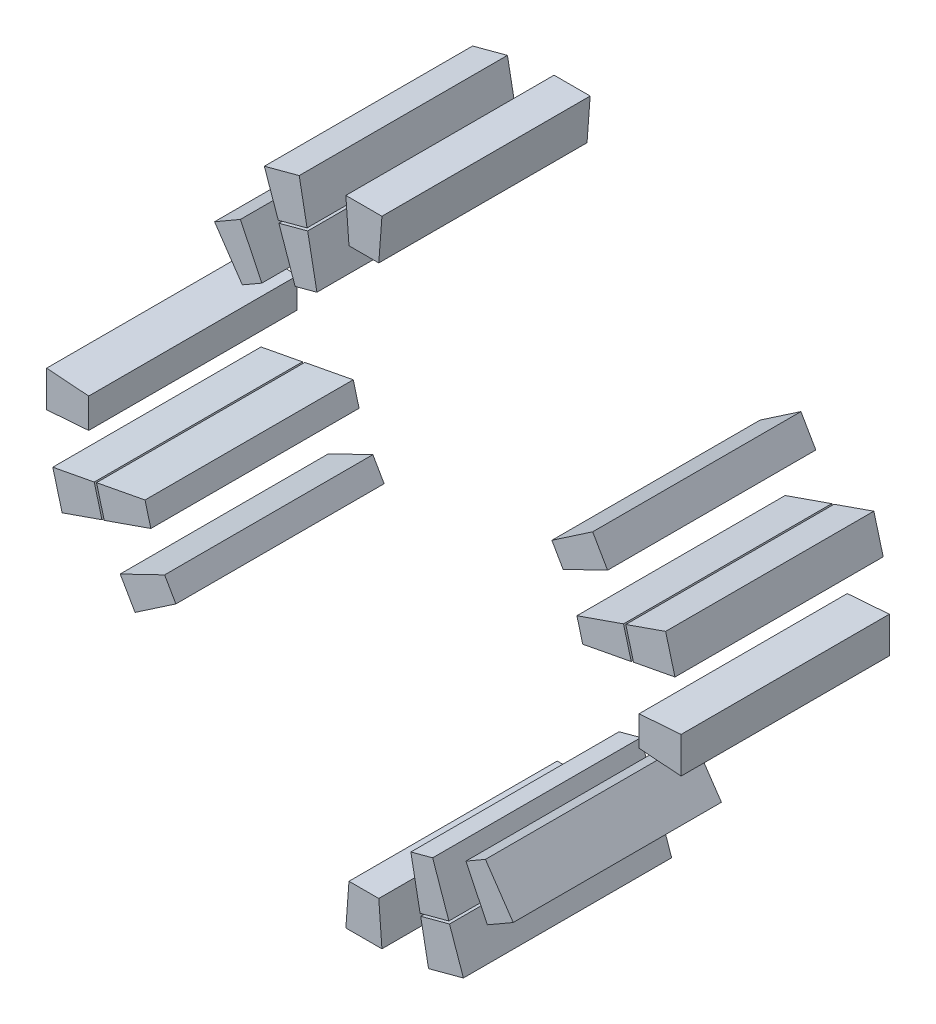
from build123d import *

# Parameters (mm, degrees)
COIL_SIDES_START    = -15
COIL_SIDES_DEPTH    = 30
COIL_SIDES_2_DEPTH  = 30
COIL_SIDES_3_DEPTH  = 30
COIL_SIDES_4_DEPTH  = 30
COIL_SIDES_5_DEPTH  = 30
COIL_SIDES_6_DEPTH  = 30
COIL_SIDES_7_DEPTH  = 30
COIL_SIDES_8_DEPTH  = 30
COIL_SIDES_9_DEPTH  = 30
COIL_SIDES_10_DEPTH = 30
COIL_SIDES_11_DEPTH = 30
COIL_SIDES_12_DEPTH = 30
COIL_SIDES_13_DEPTH = 30
COIL_SIDES_14_DEPTH = 30
COIL_SIDES_15_DEPTH = 30
COIL_SIDES_16_DEPTH = 30


with BuildPart() as part:
    # Эскиз1 → Coil_sides (new body)
    with BuildSketch(Plane.XY.offset(COIL_SIDES_START)):
        Polygon((39.64188455, -2.147321429), (45.7, -2.6), (45.7, 2.6), (39.64188455, 2.147321429), align=None)
    extrude(amount=COIL_SIDES_DEPTH)


with BuildPart() as body_2:
    # Эскиз1 → Coil_sides 2 (new body)
    with BuildSketch(Plane.XY.offset(COIL_SIDES_START)):
        Polygon((31.532118785, 6.766681971), (38.516652655, 8.097435247), (37.405117291, 12.245741698), (30.690956889, 9.905940906), align=None)
    extrude(amount=COIL_SIDES_2_DEPTH)


with BuildPart() as body_3:
    # Эскиз1 → Coil_sides 3 (new body)
    with BuildSketch(Plane.XY.offset(COIL_SIDES_START)):
        Polygon((38.846887771, 8.18592148), (44.815739779, 9.316623213), (43.469880744, 14.33943751), (37.735352408, 12.334227931), align=None)
    extrude(amount=COIL_SIDES_3_DEPTH)


with BuildPart() as body_4:
    # Эскиз1 → Coil_sides 4 (new body)
    with BuildSketch(Plane.XY.offset(COIL_SIDES_START)):
        Polygon((28.706341726, 14.697225748), (35.108459083, 17.790365093), (32.961137654, 21.509634907), (27.081341726, 17.511808311), align=None)
    extrude(amount=COIL_SIDES_4_DEPTH)


with BuildPart() as body_5:
    # Эскиз1 → Coil_sides 5 (new body)
    with BuildSketch(Plane.XY.offset(COIL_SIDES_START)):
        Polygon((2.147321429, 39.64188455), (2.6, 45.7), (-2.6, 45.7), (-2.147321429, 39.64188455), align=None)
    extrude(amount=COIL_SIDES_5_DEPTH)


with BuildPart() as body_6:
    # Эскиз1 → Coil_sides 6 (new body)
    with BuildSketch(Plane.XY.offset(COIL_SIDES_START)):
        Polygon((-6.766681971, 31.532118785), (-8.097435247, 38.516652655), (-12.245741698, 37.405117291), (-9.905940906, 30.690956889), align=None)
    extrude(amount=COIL_SIDES_6_DEPTH)


with BuildPart() as body_7:
    # Эскиз1 → Coil_sides 7 (new body)
    with BuildSketch(Plane.XY.offset(COIL_SIDES_START)):
        Polygon((-8.18592148, 38.846887771), (-9.316623213, 44.815739779), (-14.33943751, 43.469880744), (-12.334227931, 37.735352408), align=None)
    extrude(amount=COIL_SIDES_7_DEPTH)


with BuildPart() as body_8:
    # Эскиз1 → Coil_sides 8 (new body)
    with BuildSketch(Plane.XY.offset(COIL_SIDES_START)):
        Polygon((-14.697225748, 28.706341726), (-17.790365093, 35.108459083), (-21.509634907, 32.961137654), (-17.511808311, 27.081341726), align=None)
    extrude(amount=COIL_SIDES_8_DEPTH)


with BuildPart() as body_9:
    # Эскиз1 → Coil_sides 9 (new body)
    with BuildSketch(Plane.XY.offset(COIL_SIDES_START)):
        Polygon((-39.64188455, 2.147321429), (-45.7, 2.6), (-45.7, -2.6), (-39.64188455, -2.147321429), align=None)
    extrude(amount=COIL_SIDES_9_DEPTH)


with BuildPart() as body_10:
    # Эскиз1 → Coil_sides 10 (new body)
    with BuildSketch(Plane.XY.offset(COIL_SIDES_START)):
        Polygon((-31.532118785, -6.766681971), (-38.516652655, -8.097435247), (-37.405117291, -12.245741698), (-30.690956889, -9.905940906), align=None)
    extrude(amount=COIL_SIDES_10_DEPTH)


with BuildPart() as body_11:
    # Эскиз1 → Coil_sides 11 (new body)
    with BuildSketch(Plane.XY.offset(COIL_SIDES_START)):
        Polygon((-38.846887771, -8.18592148), (-44.815739779, -9.316623213), (-43.469880744, -14.33943751), (-37.735352408, -12.334227931), align=None)
    extrude(amount=COIL_SIDES_11_DEPTH)


with BuildPart() as body_12:
    # Эскиз1 → Coil_sides 12 (new body)
    with BuildSketch(Plane.XY.offset(COIL_SIDES_START)):
        Polygon((-28.706341726, -14.697225748), (-35.108459083, -17.790365093), (-32.961137654, -21.509634907), (-27.081341726, -17.511808311), align=None)
    extrude(amount=COIL_SIDES_12_DEPTH)


with BuildPart() as body_13:
    # Эскиз1 → Coil_sides 13 (new body)
    with BuildSketch(Plane.XY.offset(COIL_SIDES_START)):
        Polygon((-2.147321429, -39.64188455), (-2.6, -45.7), (2.6, -45.7), (2.147321429, -39.64188455), align=None)
    extrude(amount=COIL_SIDES_13_DEPTH)


with BuildPart() as body_14:
    # Эскиз1 → Coil_sides 14 (new body)
    with BuildSketch(Plane.XY.offset(COIL_SIDES_START)):
        Polygon((6.766681971, -31.532118785), (8.097435247, -38.516652655), (12.245741698, -37.405117291), (9.905940906, -30.690956889), align=None)
    extrude(amount=COIL_SIDES_14_DEPTH)


with BuildPart() as body_15:
    # Эскиз1 → Coil_sides 15 (new body)
    with BuildSketch(Plane.XY.offset(COIL_SIDES_START)):
        Polygon((8.18592148, -38.846887771), (9.316623213, -44.815739779), (14.33943751, -43.469880744), (12.334227931, -37.735352408), align=None)
    extrude(amount=COIL_SIDES_15_DEPTH)


with BuildPart() as body_16:
    # Эскиз1 → Coil_sides 16 (new body)
    with BuildSketch(Plane.XY.offset(COIL_SIDES_START)):
        Polygon((14.697225748, -28.706341726), (17.790365093, -35.108459083), (21.509634907, -32.961137654), (17.511808311, -27.081341726), align=None)
    extrude(amount=COIL_SIDES_16_DEPTH)


solid = Compound([part.part, body_2.part, body_3.part, body_4.part, body_5.part, body_6.part, body_7.part, body_8.part, body_9.part, body_10.part, body_11.part, body_12.part, body_13.part, body_14.part, body_15.part, body_16.part])
